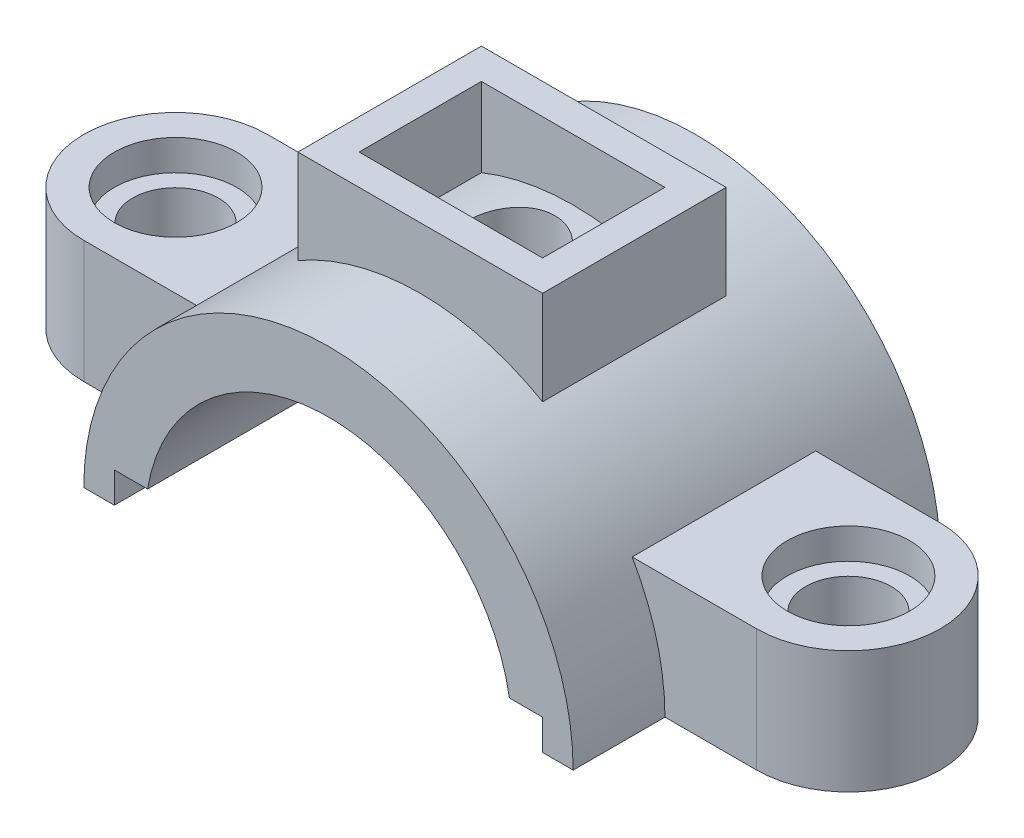
from build123d import *

# Parameters (mm, degrees)
BOSS_EXTRUDE1_DEPTH      = 20
BOSS_EXTRUDE2_DEPTH      = 30
BOSS_EXTRUDE3_REACH      = 93.104
BOSS_EXTRUDE3_END_RADIUS = 40
SKETCH3_W                = 40
SKETCH3_H                = 30
SKETCH3_W_2              = 30
SKETCH3_H_2              = 20
CUT_EXTRUDE1_DEPTH       = 105.880884817
CUT_EXTRUDE1_DEPTH_BACK  = 105.880884817
SKETCH5_W                = 70
SKETCH5_H                = 5
CUT_EXTRUDE2_DEPTH       = 105.880884817
HOLE1_D                  = 14
HOLE3_D                  = 14
HOLE3_DEPTH              = 20
HOLE3_CBORE_D            = 20
HOLE3_CBORE_DEPTH        = 5
HOLE3_TIP                = 4.206024333


with BuildPart() as part:
    # Sketch1 → Boss-Extrude1 (new body)
    with BuildSketch(Plane(origin=(0, 0, 0), x_dir=(1, 0, 0), z_dir=(0, 1, 0))):
        with BuildLine():
            Line((-55, 15), (55, 15))
            ThreePointArc((55, 15), (70, 0), (55, -15))
            Line((55, -15), (-55, -15))
            ThreePointArc((-55, -15), (-70, 0), (-55, 15))
        make_face()
    extrude(amount=BOSS_EXTRUDE1_DEPTH)

    # Sketch2 → Boss-Extrude2 (add, symmetric)
    with BuildSketch(Plane.XY):
        with BuildLine():
            Line((-40, 0), (40, 0))
            ThreePointArc((40, 0), (0, 40), (-40, 0))
        make_face()
    extrude(amount=BOSS_EXTRUDE2_DEPTH, both=True)

    # Boss-Extrude3: up to this cylinder (the profile starts outside it)
    boss_extrude3_end = Plane(origin=(0, 0, -14.5), z_dir=(0, 0, -1)) * Cylinder(BOSS_EXTRUDE3_END_RADIUS, 267.208, mode=Mode.PRIVATE)
    # Sketch3 → Boss-Extrude3 (add, up to the surface)
    with BuildSketch(Plane(origin=(0, 50, 0), x_dir=(1, 0, 0), z_dir=(0, 1, 0)), mode=Mode.PRIVATE) as boss_extrude3_sk1:
        Rectangle(SKETCH3_W, SKETCH3_H)
        Rectangle(SKETCH3_W_2, SKETCH3_H_2, mode=Mode.SUBTRACT)
    boss_extrude3_tool1 = extrude(boss_extrude3_sk1.sketch, amount=-BOSS_EXTRUDE3_REACH, mode=Mode.PRIVATE) - boss_extrude3_end
    add(boss_extrude3_tool1.solids().sort_by_distance((0, 50, -14.5))[0])

    # Sketch4 → Cut-Extrude1 (cut, two sides: drawn at the far end of the back side and taken through both)
    with BuildSketch(Plane.XY.offset(30).offset(-CUT_EXTRUDE1_DEPTH_BACK)):
        with BuildLine():
            Line((-30, 0), (30, 0))
            ThreePointArc((30, 0), (0, 30), (-30, 0))
        make_face()
    extrude(amount=CUT_EXTRUDE1_DEPTH + CUT_EXTRUDE1_DEPTH_BACK, mode=Mode.SUBTRACT)

    # Sketch5 → Cut-Extrude2 (cut, through all)
    with BuildSketch(Plane.XY.offset(30)):
        with Locations((0, 2.5)):
            Rectangle(SKETCH5_W, SKETCH5_H)
    extrude(amount=-CUT_EXTRUDE2_DEPTH, mode=Mode.SUBTRACT)

    # Hole1 (through all)
    with Locations(Plane(origin=(0, 50, 0), x_dir=(1, 0, 0), z_dir=(0, 1, 0))):
        with Locations((0, 0)):
            Hole(HOLE1_D / 2)

    # Hole3
    with Locations(Plane(origin=(0, 20, 0), x_dir=(1, 0, 0), z_dir=(0, 1, 0))):
        with Locations((-55, 0), (55, 0)):
            CounterBoreHole(HOLE3_D / 2, HOLE3_CBORE_D / 2, HOLE3_CBORE_DEPTH, depth=HOLE3_DEPTH)
            with Locations((0, 0, -(HOLE3_DEPTH + HOLE3_TIP / 2))):  # 118° drill point
                Cone(0, HOLE3_D / 2, HOLE3_TIP, mode=Mode.SUBTRACT)


solid = part.part
